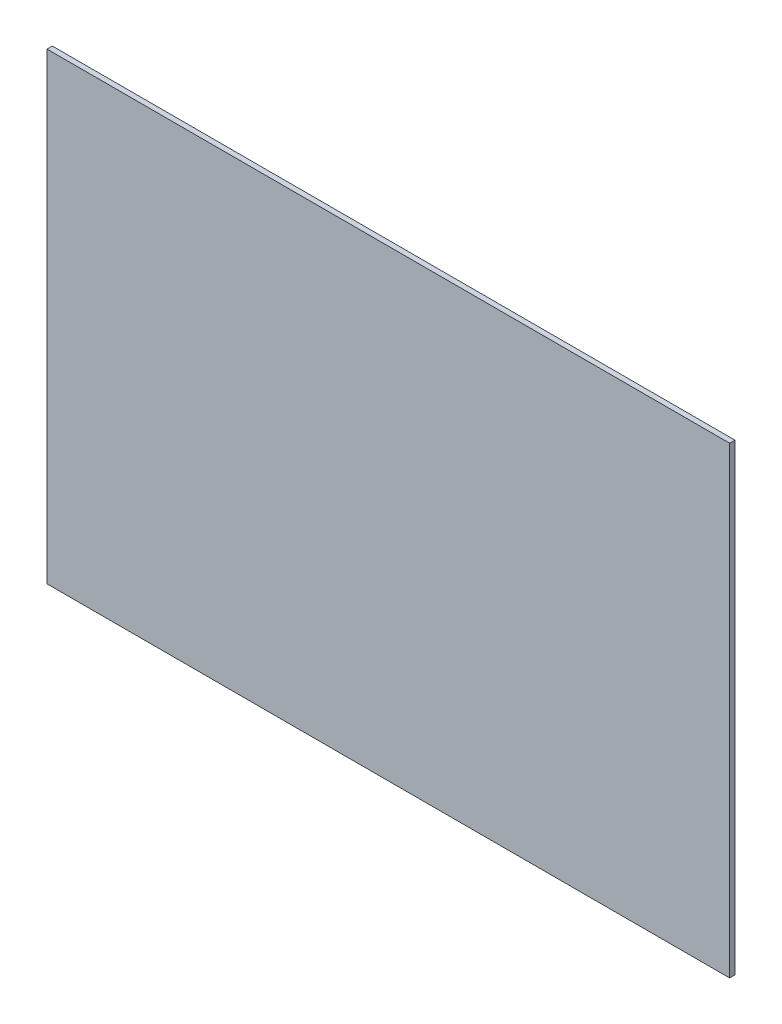
from build123d import *

# Parameters (mm, degrees)
ESQUISSE1_W        = 513
ESQUISSE1_H        = 348
BOSS_EXTRU_1_DEPTH = 4


with BuildPart() as part:
    # Esquisse1 → Boss.-Extru.1 (new body)
    with BuildSketch(Plane.XY):
        Rectangle(ESQUISSE1_W, ESQUISSE1_H)
    extrude(amount=BOSS_EXTRU_1_DEPTH)


solid = part.part
